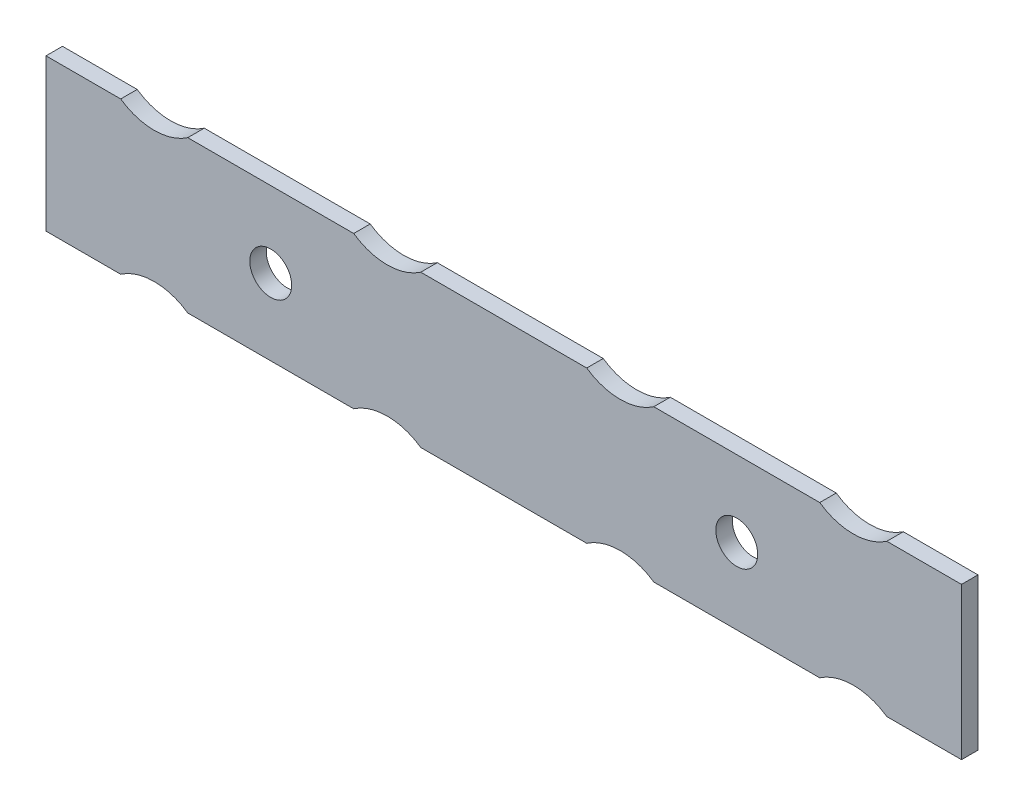
from build123d import *

# Parameters (mm, degrees)
SKETCH1_R           = 2.032
BOSS_EXTRUDE1_DEPTH = 1.6


with BuildPart() as part:
    # Sketch1 → Boss-Extrude1 (new body)
    with BuildSketch(Plane.XY):
        with BuildLine():
            Line((3.253099445, 19.430000002), (19.352900555, 19.430000002))
            ThreePointArc((19.352900555, 19.430000002), (22.606, 18.414000002), (25.859099445, 19.430000002))
            Line((25.859099445, 19.430000002), (41.958900555, 19.430000002))
            ThreePointArc((41.958900555, 19.430000002), (45.212, 18.414000002), (48.465099445, 19.430000002))
            Line((48.465099445, 19.430000002), (64.564900555, 19.430000002))
            ThreePointArc((64.564900555, 19.430000002), (67.818, 18.414000002), (71.071099445, 19.430000002))
            Line((71.071099445, 19.430000002), (78.318, 19.430000002))
            Line((78.318, 19.430000002), (78.318, 4.699999998))
            Line((78.318, 4.699999998), (71.071099445, 4.699999998))
            ThreePointArc((71.071099445, 4.699999998), (67.818, 5.715999998), (64.564900555, 4.699999998))
            Line((64.564900555, 4.699999998), (48.465099445, 4.699999998))
            ThreePointArc((48.465099445, 4.699999998), (45.212, 5.715999998), (41.958900555, 4.699999998))
            Line((41.958900555, 4.699999998), (25.859099445, 4.699999998))
            ThreePointArc((25.859099445, 4.699999998), (22.606, 5.715999998), (19.352900555, 4.699999998))
            Line((19.352900555, 4.699999998), (3.253099445, 4.699999998))
            ThreePointArc((3.253099445, 4.699999998), (0, 5.715999998), (-3.253099445, 4.699999998))
            Line((-3.253099445, 4.699999998), (-10.5, 4.699999998))
            Line((-10.5, 4.699999998), (-10.5, 19.430000002))
            Line((-10.5, 19.430000002), (-3.253099445, 19.430000002))
            ThreePointArc((-3.253099445, 19.430000002), (0, 18.414000002), (3.253099445, 19.430000002))
        make_face()
        with Locations((11.303, 12.065)):
            Circle(SKETCH1_R, mode=Mode.SUBTRACT)
        with Locations((56.515, 12.065)):
            Circle(SKETCH1_R, mode=Mode.SUBTRACT)
    extrude(amount=BOSS_EXTRUDE1_DEPTH)


solid = part.part
